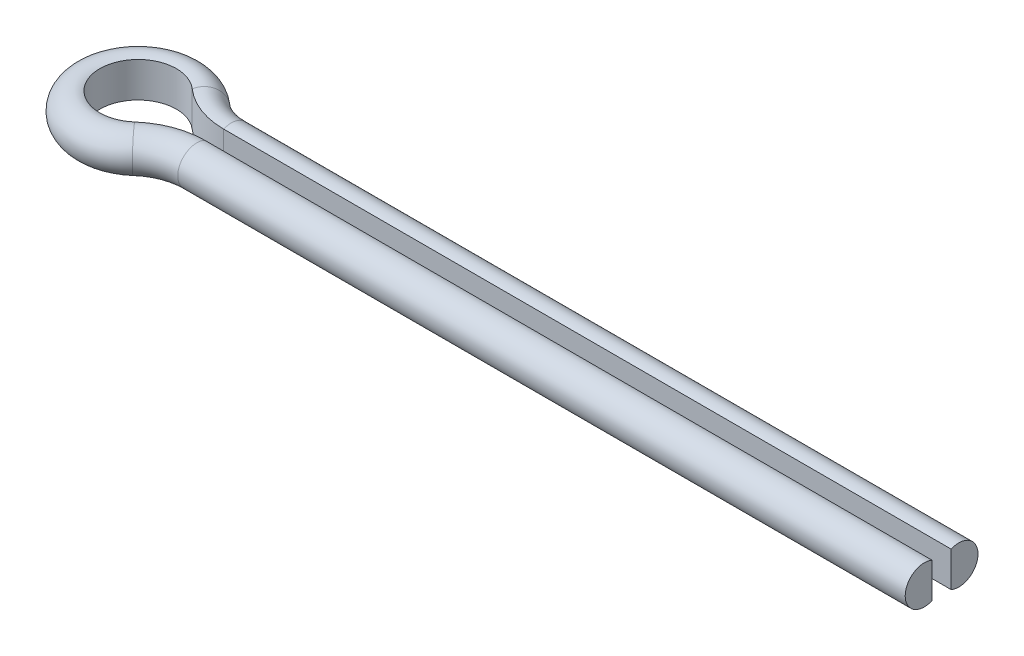
from build123d import *


with BuildPart() as part:
    # Sweep1: sweep along a path in Sketch2
    with BuildLine(Plane(origin=(0, 0, 0), x_dir=(1, 0, 0), z_dir=(0, 1, 0))) as sweep1_path:
        Line((104.841229183, 1.25), (9.921567416, 1.25))
        ThreePointArc((9.921567416, 1.25), (6.386033511, 1.895856533), (3.307189139, 3.75))
        ThreePointArc((3.307189139, 3.75), (-5, 0), (3.307189139, -3.75))
        ThreePointArc((3.307189139, -3.75), (6.386033511, -1.895856533), (9.921567416, -1.25))
        Line((9.921567416, -1.25), (104.841229183, -1.25))
    # Sketch3 → Sweep1 (sweep)
    with BuildSketch(Plane.ZY.offset(-104.841229183)):
        with BuildLine():
            Line((1.25, 2.291287847), (1.25, -2.291287847))
            ThreePointArc((1.25, -2.291287847), (4.75, 0), (1.25, 2.291287847))
        make_face()
    sweep(path=sweep1_path.line)


solid = part.part
